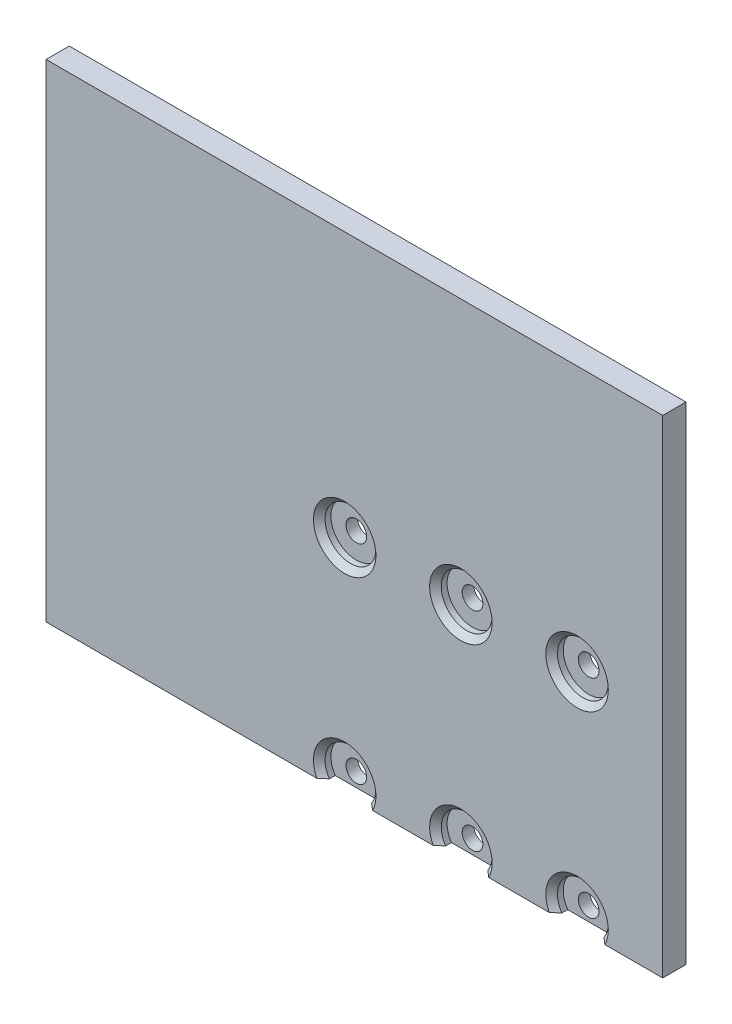
from build123d import *

# Parameters (mm, degrees)
SKETCH1_W           = 67.400289577
SKETCH1_H           = 53.248033992
BOSS_EXTRUDE1_DEPTH = 2.54
LPATTERN1_COUNT     = 3
LPATTERN1_PITCH     = 12.7


with BuildPart() as part:
    # Sketch1 → Boss-Extrude1 (new body)
    with BuildSketch(Plane.XY):
        with Locations((-29.774643138, 13.689630717)):
            Rectangle(SKETCH1_W, SKETCH1_H)
    extrude(amount=BOSS_EXTRUDE1_DEPTH)

    # Sketch3 → CBORE for #2 Binding Head Machine Screw1 (revolve, cut)
    with BuildSketch(Plane(origin=(-30.833791182, 11.380076337, 2.54), x_dir=(0, -1, 0), z_dir=(1, 0, 0))):
        Polygon((0, 0), (0, 2.54), (1.1303, 2.54), (1.1303, 1.27), (2.77876, 1.27), (2.77876, 0.635), (3.41376, 0), align=None)
    cbore_for_2_binding_head_machine_screw1 = revolve(axis=Axis((-30.833791182, 11.380076337, 8.89), (0, 0, -1)), mode=Mode.SUBTRACT)

    # LPattern1: CBORE for #2 Binding Head Machine Screw1 ×3
    with Locations(*[(i * LPATTERN1_PITCH, 0, 0) for i in range(1, LPATTERN1_COUNT)]):
        add(cbore_for_2_binding_head_machine_screw1, mode=Mode.SUBTRACT)

    # Mirror1: CBORE for #2 Binding Head Machine Screw1 across plane
    add(cbore_for_2_binding_head_machine_screw1.mirror(Plane.ZX), mode=Mode.SUBTRACT)

    # Mirror1 copy 1 sketch → Mirror1 copy 1 (revolve, cut)
    with BuildSketch(Plane(origin=(-18.133791182, -11.380076337, 2.54), x_dir=(0, 1, 0), z_dir=(1, 0, 0))):
        Polygon((0, 0), (0, -2.54), (1.1303, -2.54), (1.1303, -1.27), (2.77876, -1.27), (2.77876, -0.635), (3.41376, 0), align=None)
    revolve(axis=Axis((-18.133791182, -11.380076337, 8.89), (0, 0, 1)), mode=Mode.SUBTRACT)

    # Mirror1 copy 2 sketch → Mirror1 copy 2 (revolve, cut)
    with BuildSketch(Plane(origin=(-5.433791182, -11.380076337, 2.54), x_dir=(0, 1, 0), z_dir=(1, 0, 0))):
        Polygon((0, 0), (0, -2.54), (1.1303, -2.54), (1.1303, -1.27), (2.77876, -1.27), (2.77876, -0.635), (3.41376, 0), align=None)
    revolve(axis=Axis((-5.433791182, -11.380076337, 8.89), (0, 0, 1)), mode=Mode.SUBTRACT)


solid = part.part
